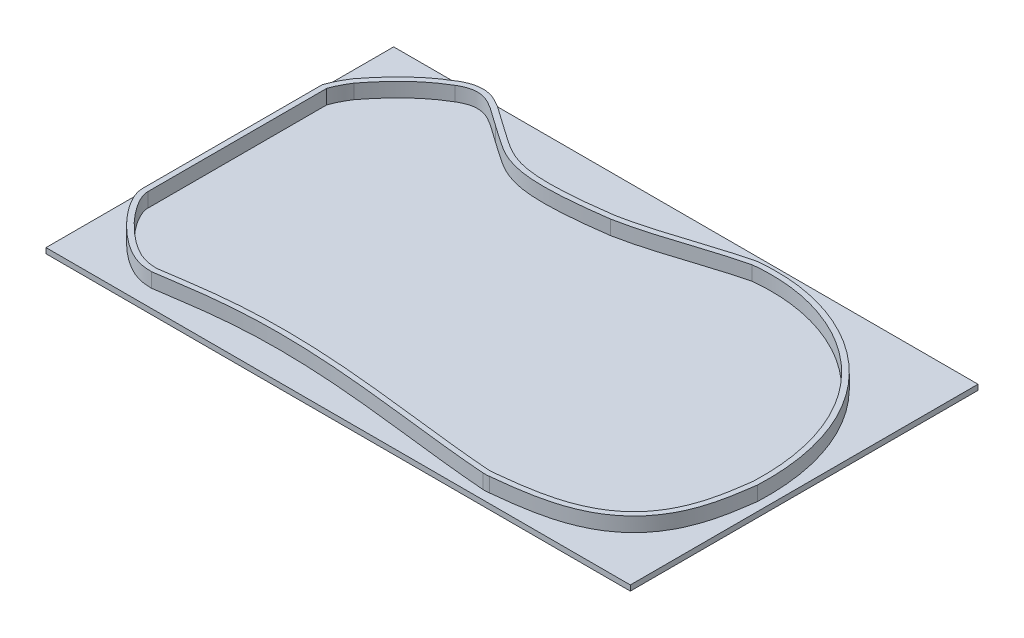
from build123d import *

# Parameters (mm, degrees)
BOSS_EXTRUDE2_DEPTH = 4
SKETCH3_W           = 162.713811117
SKETCH3_H           = 96.815600969
BOSS_EXTRUDE3_DEPTH = 1.5


with BuildPart() as part:
    # Sketch2 → Boss-Extrude2 (new body)
    with BuildSketch(Plane(origin=(0, 0, 0), x_dir=(1, 0, 0), z_dir=(0, 1, 0))):
        with BuildLine():
            Line((-78.157135648, 35.933017955), (-78.157135648, -14.112200016))
            add(Edge.make_bspline(
                [(-78.157135648, -14.112200016), (-78.155939648, -14.752373068), (-77.91728619, -15.977732307), (-77.067841768, -17.98284043), (-75.853766997, -20.009770375), (-73.882725179, -22.698478403), (-70.990105914, -25.858420252), (-67.409604046, -28.950378503), (-64.099125185, -31.13485728), (-61.237861598, -32.390367883), (-59.243018884, -32.778941146), (-57.84210102, -32.875591912), (-57.21182785, -32.900669531), (-56.88815566, -32.920328572)],
                knots=[0.000409109, 0.000409109, 0.000409109, 0.000409109, 0.062842692, 0.125276275, 0.187709857, 0.25014344, 0.375010605, 0.499877771, 0.624744936, 0.749612101, 0.874479267, 0.936912849, 0.999346432, 0.999346432, 0.999346432, 0.999346432], degree=3))
            add(Edge.make_bspline(
                [(-56.88815566, -32.920328572), (-56.642696558, -32.89075012), (-56.160280632, -32.83055745), (-55.130884334, -32.690361106), (-53.775402575, -32.490990423), (-52.023319465, -32.222109613), (-49.529202359, -31.839803624), (-46.118946018, -31.34265718), (-41.582935401, -30.787201605), (-36.628570251, -30.3313494), (-29.499663542, -29.915818278), (-19.674874473, -29.844145156), (-6.636878998, -30.578186936), (5.085601081, -31.774869617), (14.875722867, -32.919022634), (22.392678178, -33.800910905), (30.053166384, -34.637100414), (35.270389761, -35.105189919), (37.869497862, -35.297508229)],
                knots=[-0.001372968, -0.001372968, -0.001372968, -0.001372968, 0.014272852, 0.029918673, 0.061210313, 0.092501954, 0.123793594, 0.186376875, 0.248960156, 0.311543437, 0.374126718, 0.49929328, 0.624459842, 0.749626404, 0.812209685, 0.874792966, 0.937376247, 0.999959528, 0.999959528, 0.999959528, 0.999959528], degree=3))
            ThreePointArc((37.869497862, -35.297508229), (38.735359767, -35.294029869), (39.597461801, -35.21335137))
            add(Edge.make_bspline(
                [(39.597461801, -35.21335137), (41.139767175, -35.04904175), (44.235594855, -34.704530206), (50.30182099, -33.820891122), (57.45023856, -32.130120831), (64.799112885, -28.716371013), (70.578195113, -23.811075447), (73.965626007, -18.700600273), (75.883187129, -14.305672198), (76.967229357, -10.961986186), (77.747932295, -7.691449122), (78.199718827, -5.145010951), (78.480402727, -3.296584904), (78.661323244, -2.03081469), (78.823959845, -0.900875926), (78.927618693, -0.280644372), (78.981646775, 0.045841454)],
                knots=[-8.5538e-05, -8.5538e-05, -8.5538e-05, -8.5538e-05, 0.063427598, 0.126940734, 0.253967006, 0.380993278, 0.50801955, 0.635045822, 0.698558958, 0.762072094, 0.82558523, 0.889098367, 0.920854935, 0.952611503, 0.984368071, 1.016124639, 1.016124639, 1.016124639, 1.016124639], degree=3))
            add(Edge.make_bspline(
                [(78.981646775, 0.045841454), (79.027094782, 1.179674429), (79.064720926, 3.473913783), (78.944393791, 6.769688051), (78.658660296, 9.974948397), (78.064183944, 14.11691568), (76.934054174, 19.032604235), (74.364574026, 26.339835799), (69.843932164, 34.39440102), (62.712031102, 42.254317161), (54.262624742, 48.235080745), (44.879874513, 52.267066292), (34.952870186, 54.2885898), (28.210881807, 54.235085369), (24.886864743, 53.860071186)],
                knots=[-0.00040736, -0.00040736, -0.00040736, -0.00040736, 0.030879521, 0.062166401, 0.093453282, 0.124740163, 0.187313924, 0.249887685, 0.375035208, 0.50018273, 0.625330253, 0.750477775, 0.875625298, 1.00077282, 1.00077282, 1.00077282, 1.00077282], degree=3))
            add(Edge.make_bspline(
                [(24.886864743, 53.860071186), (22.283887479, 53.234934331), (17.122333316, 51.770006392), (6.978810179, 48.483475597), (-0.62058189, 46.171110399), (-5.82261915, 45.177242661)],
                knots=[-0.001280714, -0.001280714, -0.001280714, -0.001280714, 0.24771449, 0.496709693, 0.9947001, 0.9947001, 0.9947001, 0.9947001], degree=3))
            add(Edge.make_bspline(
                [(-5.82261915, 45.177242661), (-6.846271695, 45.033725935), (-8.877911438, 44.761027761), (-13.088195507, 44.259306095), (-18.264324114, 43.792662786), (-23.901821518, 43.633821839), (-28.702631501, 43.985910311), (-32.652338295, 44.908532737), (-35.447699325, 46.177033317), (-37.648428, 47.515223041), (-39.36186509, 48.682387067), (-40.924837411, 49.79297126), (-42.29202762, 50.749624529), (-43.050520295, 51.26512862), (-43.422492414, 51.515145542)],
                knots=[0.000305139, 0.000305139, 0.000305139, 0.000305139, 0.063047866, 0.125790592, 0.251276044, 0.376761496, 0.502246948, 0.627732401, 0.753217853, 0.815960579, 0.878703305, 0.941446031, 0.972817394, 1.004188757, 1.004188757, 1.004188757, 1.004188757], degree=3))
            add(Edge.make_bspline(
                [(-43.422492414, 51.515145542), (-43.678616345, 51.691810139), (-44.195843457, 52.052612418), (-45.168447607, 52.746174672), (-46.308029686, 53.571366973), (-47.576953364, 54.472121728), (-49.172650358, 55.533487702), (-51.044076917, 56.564817563), (-53.214706641, 57.25190115), (-55.319518496, 57.36517967), (-56.956778648, 57.053303598), (-58.147723245, 56.650637672), (-58.968859533, 56.298465061), (-59.57079354, 55.992027065), (-60.005881741, 55.748275575), (-60.18615305, 55.640555889), (-60.280341084, 55.583909473)],
                knots=[-0.002293809, -0.002293809, -0.002293809, -0.002293809, 0.029244556, 0.060782921, 0.123859651, 0.186936381, 0.250013112, 0.376166572, 0.502320033, 0.628473494, 0.754626954, 0.817703684, 0.880780415, 0.943857145, 0.97539551, 1.006933875, 1.006933875, 1.006933875, 1.006933875], degree=3))
            add(Edge.make_bspline(
                [(-60.280341084, 55.583909473), (-60.714952444, 55.32966131), (-61.58200578, 54.800998059), (-63.22221391, 53.718688993), (-65.910533435, 51.737250649), (-69.243121764, 48.741031753), (-72.024440988, 45.692878732), (-73.73920341, 43.627948753), (-74.665747867, 42.475614869), (-75.104907594, 41.920162476), (-75.326466464, 41.639029179)],
                knots=[0.000426683, 0.000426683, 0.000426683, 0.000426683, 0.06326809, 0.126109496, 0.251792309, 0.503157934, 0.75452356, 0.880206373, 0.943047779, 1.005889185, 1.005889185, 1.005889185, 1.005889185], degree=3))
            add(Edge.make_bspline(
                [(-75.326466464, 41.639029179), (-75.91997327, 40.746000391), (-77.006363229, 38.87012428), (-77.815024814, 36.931350625), (-78.157135648, 35.933017955)],
                knots=[0.49954614, 0.49954614, 0.49954614, 0.49954614, 0.499770438, 0.499994735, 0.499994735, 0.499994735, 0.499994735], degree=3))
        make_face()
        with BuildLine():
            Line((-76.657135648, 35.679066848), (-76.657131969, -14.112200006))
            add(Edge.make_bspline(
                [(-76.657131969, -14.112200006), (-76.656531466, -14.340940611), (-76.615532486, -14.780598422), (-76.365572342, -15.779633829), (-75.747022441, -17.26132375), (-74.637885805, -19.124336874), (-72.785033195, -21.666520065), (-70.027170511, -24.69605914), (-66.602535352, -27.672706005), (-63.476928114, -29.755963329), (-60.874171764, -30.916444124), (-58.823492797, -31.343417769), (-57.575149509, -31.379323699), (-56.935294504, -31.415052584)],
                knots=[0.000537135, 0.000537135, 0.000537135, 0.000537135, 0.031486368, 0.0624356, 0.124334065, 0.186232529, 0.248130994, 0.371927923, 0.495724853, 0.619521782, 0.743318712, 0.867115641, 0.99091257, 0.99091257, 0.99091257, 0.99091257], degree=3))
            add(Edge.make_bspline(
                [(-56.935294504, -31.415052584), (-56.694661939, -31.385667933), (-56.223603705, -31.325866144), (-55.203470476, -31.185340461), (-53.856324583, -30.986089165), (-52.101912742, -30.716485052), (-49.596504581, -30.333088531), (-46.159583081, -29.834426322), (-41.581560568, -29.27829752), (-36.581457935, -28.823458861), (-29.390698582, -28.411647175), (-19.497861615, -28.34813345), (-6.407460838, -29.092198199), (7.671085742, -30.53241701), (20.045487362, -32.035993294), (30.203761894, -33.14440123), (35.375718345, -33.608610084), (37.954323811, -33.799682751)],
                knots=[0.001496116, 0.001496116, 0.001496116, 0.001496116, 0.017093844, 0.032691572, 0.063887028, 0.095082483, 0.126277939, 0.18866885, 0.251059761, 0.313450672, 0.375841584, 0.500623406, 0.625405228, 0.750187051, 0.874968873, 0.937359784, 0.999750695, 0.999750695, 0.999750695, 0.999750695], degree=3))
            ThreePointArc((37.954323811, -33.799682751), (38.685754809, -33.794634443), (39.413826008, -33.724426748))
            add(Edge.make_bspline(
                [(39.413826008, -33.724426748), (40.941587091, -33.561666605), (44.016933216, -33.219818338), (49.974357897, -32.353936258), (56.920589371, -30.71373603), (63.928940419, -27.467086873), (69.37640321, -22.871797273), (72.592452605, -18.066629926), (74.435319216, -13.886326636), (75.48738516, -10.677838243), (76.252417838, -7.512200065), (76.699454408, -5.023141593), (76.979420749, -3.19383512), (77.160428463, -1.932130727), (77.326847127, -0.768127182), (77.43119015, -0.135396957), (77.486499649, 0.198499569)],
                knots=[-0.000425037, -0.000425037, -0.000425037, -0.000425037, 0.062921118, 0.126267272, 0.25295958, 0.379651889, 0.506344198, 0.633036506, 0.696382661, 0.759728815, 0.823074969, 0.886421123, 0.918094201, 0.949767278, 0.981440355, 1.013113432, 1.013113432, 1.013113432, 1.013113432], degree=3))
            add(Edge.make_bspline(
                [(77.486499649, 0.198499569), (77.529376832, 1.304965595), (77.563148654, 3.54640861), (77.441718254, 6.750377683), (77.160012317, 9.869265522), (76.577911195, 13.891943853), (75.476896458, 18.658811745), (72.98279324, 25.733467023), (68.609003035, 33.517419822), (61.718308835, 41.112614632), (53.552963068, 46.899058336), (44.478248309, 50.80844929), (34.878936934, 52.776287746), (28.361333333, 52.735962773), (25.146710313, 52.37977831)],
                knots=[0.000462258, 0.000462258, 0.000462258, 0.000462258, 0.031684846, 0.062907434, 0.094130022, 0.125352611, 0.187797787, 0.250242963, 0.375133316, 0.500023669, 0.624914022, 0.749804375, 0.874694728, 0.999585081, 0.999585081, 0.999585081, 0.999585081], degree=3))
            add(Edge.make_bspline(
                [(25.146710313, 52.37977831), (19.996880057, 51.137756564), (12.46311825, 48.651529878), (2.282936309, 45.485639859), (-2.943523861, 44.200173327), (-5.577592643, 43.696925109)],
                knots=[0.001647883, 0.001647883, 0.001647883, 0.001647883, 0.49875575, 0.747309683, 0.995863617, 0.995863617, 0.995863617, 0.995863617], degree=3))
            add(Edge.make_bspline(
                [(-5.577592643, 43.696925109), (-6.608686649, 43.552365086), (-8.654048562, 43.277286792), (-12.900719679, 42.770558047), (-18.1416297, 42.296463944), (-23.901116409, 42.131322734), (-28.894462751, 42.491806828), (-33.123562317, 43.472784898), (-36.152698653, 44.848626269), (-38.469673728, 46.259294554), (-40.227820016, 47.45749815), (-41.798031425, 48.573285436), (-43.149641227, 49.51893077), (-43.899165402, 50.028194293), (-44.266747833, 50.275260736)],
                knots=[-0.000445954, -0.000445954, -0.000445954, -0.000445954, 0.062356884, 0.125159722, 0.250765398, 0.376371074, 0.50197675, 0.627582426, 0.753188102, 0.81599094, 0.878793778, 0.941596616, 0.972998035, 1.004399454, 1.004399454, 1.004399454, 1.004399454], degree=3))
            add(Edge.make_bspline(
                [(-44.266747833, 50.275260736), (-44.527408356, 50.455054502), (-45.054249251, 50.822434727), (-46.041767018, 51.526583503), (-47.182852187, 52.352899291), (-48.430502857, 53.238394378), (-49.959355128, 54.254926441), (-51.669032297, 55.190671355), (-53.504011998, 55.762856637), (-55.217112111, 55.853610566), (-56.862754072, 55.542492613), (-58.118908127, 55.048422463), (-58.991920159, 54.602781729), (-59.334940415, 54.402109669), (-59.515062385, 54.293781003)],
                knots=[-0.002598924, -0.002598924, -0.002598924, -0.002598924, 0.0289762, 0.060551324, 0.123701572, 0.18685182, 0.250002068, 0.376302564, 0.502603061, 0.628903557, 0.755204053, 0.881504549, 0.944654797, 1.007805046, 1.007805046, 1.007805046, 1.007805046], degree=3))
            add(Edge.make_bspline(
                [(-59.515062385, 54.293781003), (-59.933000678, 54.049286604), (-60.767107189, 53.541199426), (-62.34414566, 52.501351132), (-64.932965719, 50.59560099), (-68.153458432, 47.704906594), (-70.856343693, 44.749408068), (-72.789087262, 42.425042933), (-73.666165752, 41.322178137), (-74.110264621, 40.758884118)],
                knots=[4.7776e-05, 4.7776e-05, 4.7776e-05, 4.7776e-05, 0.062686674, 0.125325571, 0.250603366, 0.501158957, 0.751714547, 0.876992343, 1.002270138, 1.002270138, 1.002270138, 1.002270138], degree=3))
            add(Edge.make_bspline(
                [(-74.110264621, 40.758884118), (-74.638638681, 39.959603427), (-75.611693177, 38.281434426), (-76.343021988, 36.564567869), (-76.657135648, 35.679066848)],
                knots=[0.49955057, 0.49955057, 0.49955057, 0.49955057, 0.499763362, 0.499976154, 0.499976154, 0.499976154, 0.499976154], degree=3))
        make_face(mode=Mode.SUBTRACT)
    extrude(amount=BOSS_EXTRUDE2_DEPTH)

    # Sketch3 → Boss-Extrude3 (add)
    with BuildSketch(Plane.XZ):
        with Locations((0.019032639, -10.611106307)):
            Rectangle(SKETCH3_W, SKETCH3_H)
    extrude(amount=BOSS_EXTRUDE3_DEPTH)


solid = part.part
